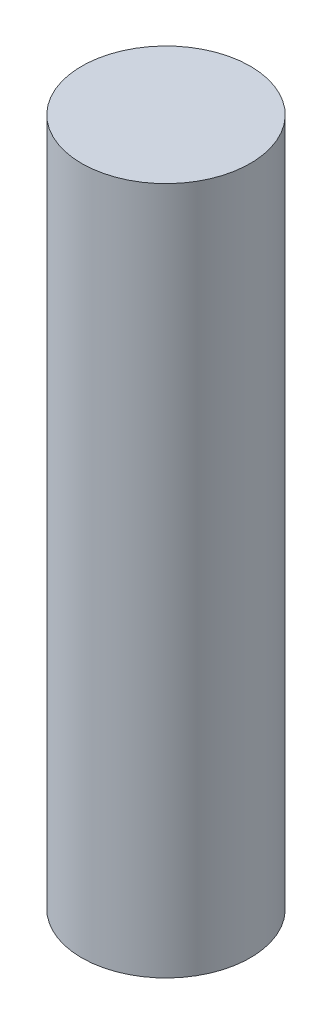
from build123d import *

# Parameters (mm, degrees)
SKETCH1_R           = 3.175
BOSS_EXTRUDE1_DEPTH = 25.4
SKETCH2_W           = 5.08
SKETCH2_H           = 2.9464
CUT_EXTRUDE1_DEPTH  = 9.144
BOSS_EXTRUDE2_START = 0.508
SKETCH3_R           = 3.175
BOSS_EXTRUDE2_DEPTH = 0.508
SKETCH4_R           = 2.667
SKETCH4_W           = 5.08
SKETCH4_H           = 2.921
CUT_EXTRUDE2_DEPTH  = 1.524


with BuildPart() as part:
    # Sketch1 → Boss-Extrude1 (new body)
    with BuildSketch(Plane(origin=(0, 0, 0), x_dir=(1, 0, 0), z_dir=(0, 1, 0))):
        Circle(SKETCH1_R)
    extrude(amount=BOSS_EXTRUDE1_DEPTH)

    # Sketch2 → Cut-Extrude1 (cut)
    with BuildSketch(Plane.XZ):
        Rectangle(SKETCH2_W, SKETCH2_H)
    extrude(amount=-CUT_EXTRUDE1_DEPTH, mode=Mode.SUBTRACT)

    # Sketch3 → Boss-Extrude2 (add)
    with BuildSketch(Plane.XZ.offset(BOSS_EXTRUDE2_START)):
        Circle(SKETCH3_R)
    extrude(amount=-BOSS_EXTRUDE2_DEPTH)

    # Sketch4 → Cut-Extrude2 (cut)
    with BuildSketch(Plane.XZ.offset(0.508)):
        Circle(SKETCH4_R)
        Rectangle(SKETCH4_W, SKETCH4_H)
    extrude(amount=-CUT_EXTRUDE2_DEPTH, mode=Mode.SUBTRACT)


solid = part.part
